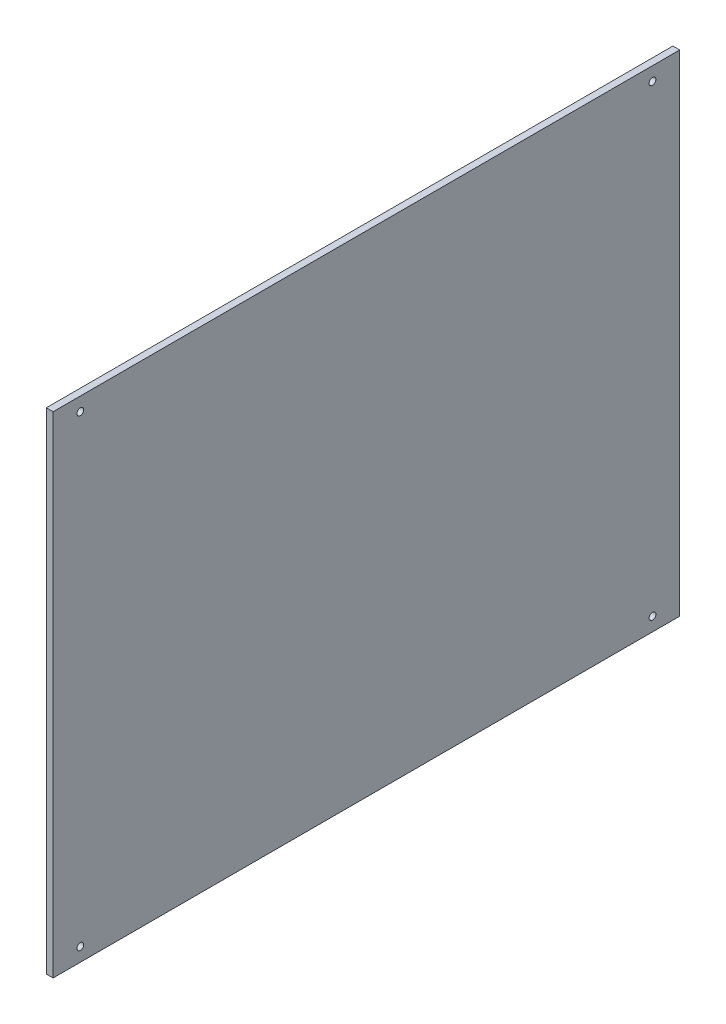
from build123d import *

# Parameters (mm, degrees)
SKETCH2_W               = 292.1
SKETCH2_H               = 228.6
BOSS_EXTRUDE1_DEPTH     = 3.175
SKETCH3_R               = 1.5875
CUT_EXTRUDE1_DEPTH      = 186.486315196
MIRROR2_COPY_1_SKETCH_R = 1.5875
MIRROR2_COPY_1_DEPTH    = 186.486315196


with BuildPart() as part:
    # Sketch2 → Boss-Extrude1 (new body)
    with BuildSketch(Plane(origin=(0, 0, 0), x_dir=(0, 0, -1), z_dir=(1, 0, 0))):
        Rectangle(SKETCH2_W, SKETCH2_H)
    extrude(amount=BOSS_EXTRUDE1_DEPTH)

    # Sketch3 → Cut-Extrude1 (cut, through all)
    with BuildSketch(Plane(origin=(3.175, 0, 0), x_dir=(0, 0, -1), z_dir=(1, 0, 0))):
        with Locations((-133.35, -107.95)):
            Circle(SKETCH3_R)
    cut_extrude1 = extrude(amount=-CUT_EXTRUDE1_DEPTH, mode=Mode.SUBTRACT)

    # Mirror1: Cut-Extrude1 across plane
    add(cut_extrude1.mirror(Plane.ZX), mode=Mode.SUBTRACT)

    # Mirror2: Cut-Extrude1 across plane
    add(cut_extrude1.mirror(Plane.XY), mode=Mode.SUBTRACT)

    # Mirror2 copy 1 sketch → Mirror2 copy 1 (cut, through all)
    with BuildSketch(Plane(origin=(3.175, 0, 0), x_dir=(0, 0, 1), z_dir=(1, 0, 0))):
        with Locations((-133.35, -107.95)):
            Circle(MIRROR2_COPY_1_SKETCH_R)
    extrude(amount=-MIRROR2_COPY_1_DEPTH, mode=Mode.SUBTRACT)


solid = part.part
